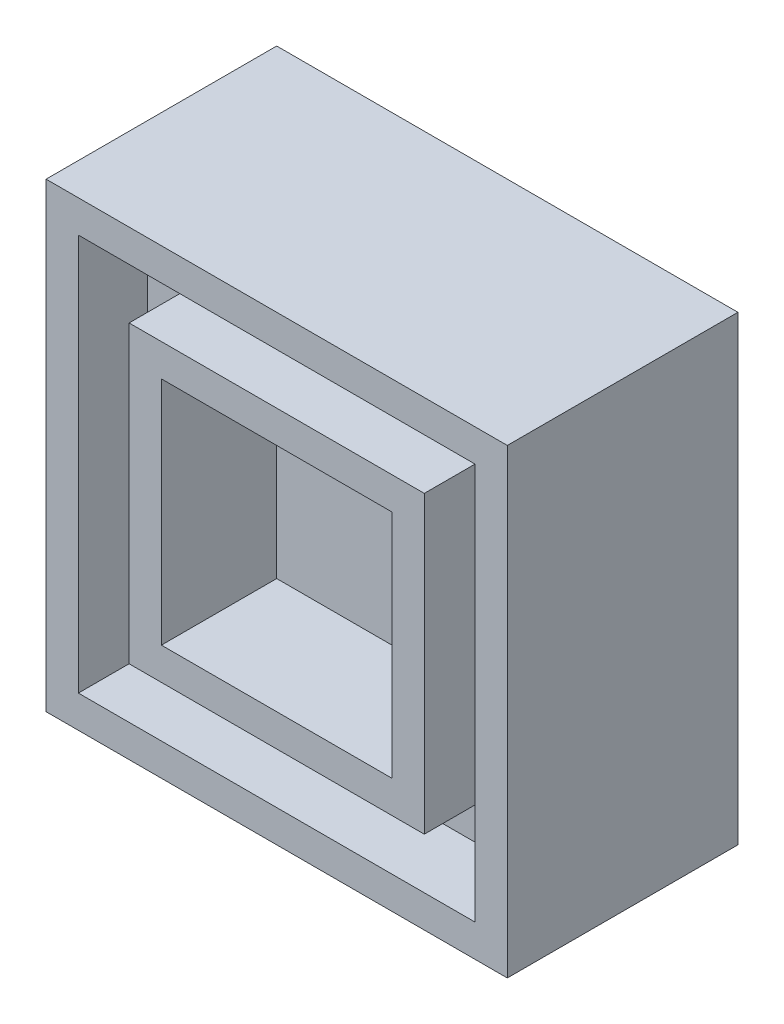
from build123d import *

# Parameters (mm, degrees)
SKETCH_1_W          = 20
SKETCH_1_H          = 20
EXTRUDE_1_DEPTH     = 10
SHELL_1_T           = -5
SKETCH_3_W          = 17.2
SKETCH_3_H          = 17.2
SKETCH_3_W_2        = 12.8
SKETCH_3_H_2        = 12.8
CUT_EXTRUDE_1_DEPTH = 3


with BuildPart() as part:
    # ｽｹｯﾁ1 → ﾎﾞｽ - 押し出し1 (new body)
    with BuildSketch(Plane.XY):
        Rectangle(SKETCH_1_W, SKETCH_1_H)
    extrude(amount=EXTRUDE_1_DEPTH)

    # ｼｪﾙ1
    shell_1_openings = [part.faces().sort_by_distance(p)[0] for p in [
        (0, 0, 10),
    ]]
    offset(amount=SHELL_1_T, openings=shell_1_openings, kind=Kind.INTERSECTION)

    # ｽｹｯﾁ3 → ｶｯﾄ - 押し出し1 (cut)
    with BuildSketch(Plane.XY.offset(10)):
        Rectangle(SKETCH_3_W, SKETCH_3_H)
        Rectangle(SKETCH_3_W_2, SKETCH_3_H_2, mode=Mode.SUBTRACT)
    extrude(amount=-CUT_EXTRUDE_1_DEPTH, mode=Mode.SUBTRACT)


solid = part.part
